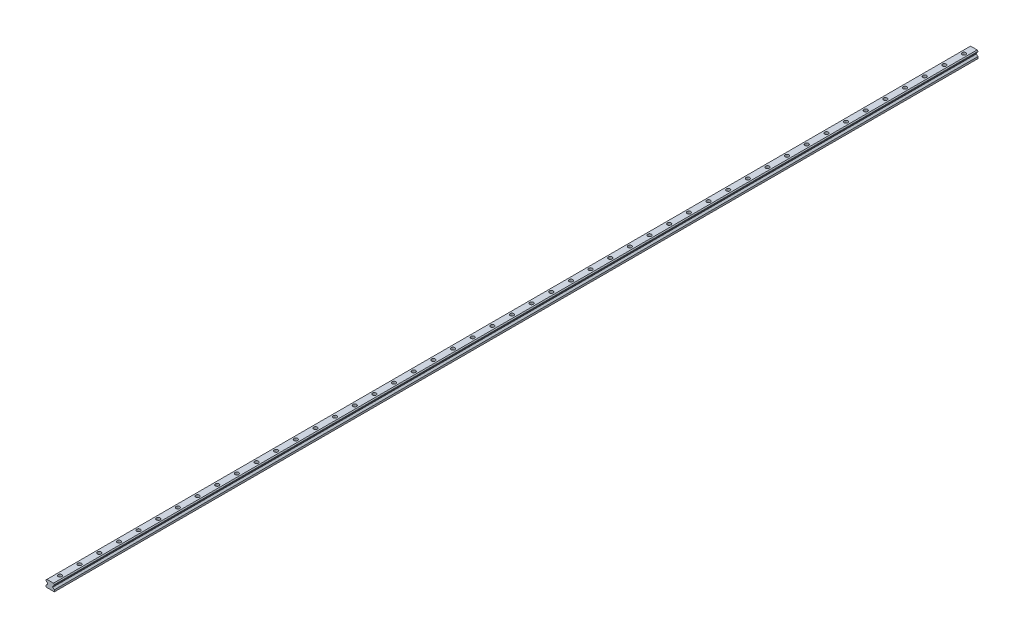
from build123d import *

# Parameters (mm, degrees)
EXTRUDE_1_DEPTH              = 1880
HOLE_WIZARD_M8_1_D           = 9
HOLE_WIZARD_M8_1_CBORE_D     = 15
HOLE_WIZARD_M8_1_CBORE_DEPTH = 12
PATTERN_LINEAR_1_COUNT       = 47
PATTERN_LINEAR_1_PITCH       = 80


with BuildPart() as part:
    # 草圖1 → 伸長1 (new, symmetric)
    with BuildSketch(Plane.XY):
        Polygon((17, 0), (-17, 0), (-17, 7.5), (-10, 12.721375014), (-10, 16.129907798), (-17, 23.129907798), (-17, 25.4259063), (-13.4259063, 29), (13.4259063, 29), (17, 25.4259063), (17, 23.129907798), (10, 16.129907798), (10, 12.721375014), (17, 7.5), align=None)
    extrude(amount=EXTRUDE_1_DEPTH, both=True)

    # M8 內六角圓柱頭螺釘的柱孔1 (through all)
    with Locations(Plane(origin=(0, 29, 0), x_dir=(-1, 0, 0), z_dir=(0, 1, 0))):
        with Locations((0, -1840)):
            hole_wizard_m8_1 = CounterBoreHole(HOLE_WIZARD_M8_1_D / 2, HOLE_WIZARD_M8_1_CBORE_D / 2, HOLE_WIZARD_M8_1_CBORE_DEPTH)

    # 直線複製排列1: M8 內六角圓柱頭螺釘的柱孔1 ×47
    with Locations(*[(0, 0, i * PATTERN_LINEAR_1_PITCH) for i in range(1, PATTERN_LINEAR_1_COUNT)]):
        add(hole_wizard_m8_1, mode=Mode.SUBTRACT)


solid = part.part
